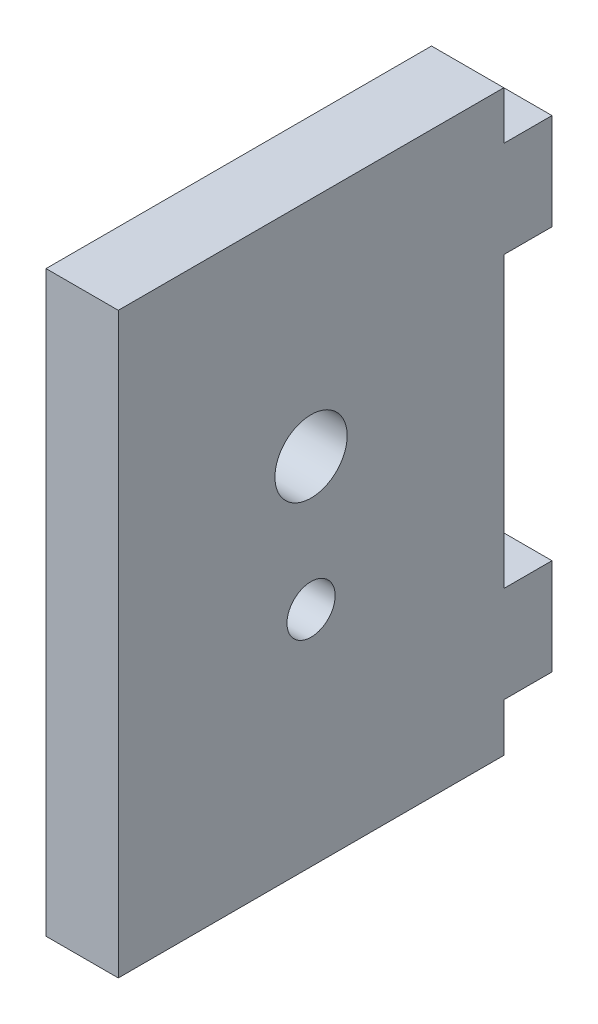
from build123d import *

# Parameters (mm, degrees)
SKETCH1_W           = 76.2
SKETCH1_H           = 50.8
BOSS_EXTRUDE1_DEPTH = 9.525
SKETCH3_R           = 3.175
SKETCH3_R_2         = 4.7625
CUT_EXTRUDE1_DEPTH  = 93.075
SKETCH4_W           = 9.525
SKETCH4_H           = 12.7
BOSS_EXTRUDE2_DEPTH = 6.35


with BuildPart() as part:
    # Sketch1 → Boss-Extrude1 (new body)
    with BuildSketch(Plane.YZ):
        with Locations((38.1, 25.4)):
            Rectangle(SKETCH1_W, SKETCH1_H)
    extrude(amount=BOSS_EXTRUDE1_DEPTH)

    # Sketch3 → Cut-Extrude1 (cut, through all)
    with BuildSketch(Plane.YZ.offset(9.525)):
        with Locations(Location((29.36875, 25.4, 0), (0, 0, 270))):
            Circle(SKETCH3_R)
        with Locations(Location((46.83125, 25.4, 0), (0, 0, 270))):
            Circle(SKETCH3_R_2)
    extrude(amount=-CUT_EXTRUDE1_DEPTH, mode=Mode.SUBTRACT)

    # Sketch4 → Boss-Extrude2 (add)
    with BuildSketch(Plane(origin=(0, 0, 0), x_dir=(1, 0, 0), z_dir=(0, 0, -1))):
        with Locations((4.7625, -12.7)):
            Rectangle(SKETCH4_W, SKETCH4_H)
        with Locations((4.7625, -63.5)):
            Rectangle(SKETCH4_W, SKETCH4_H)
    extrude(amount=BOSS_EXTRUDE2_DEPTH)


solid = part.part
